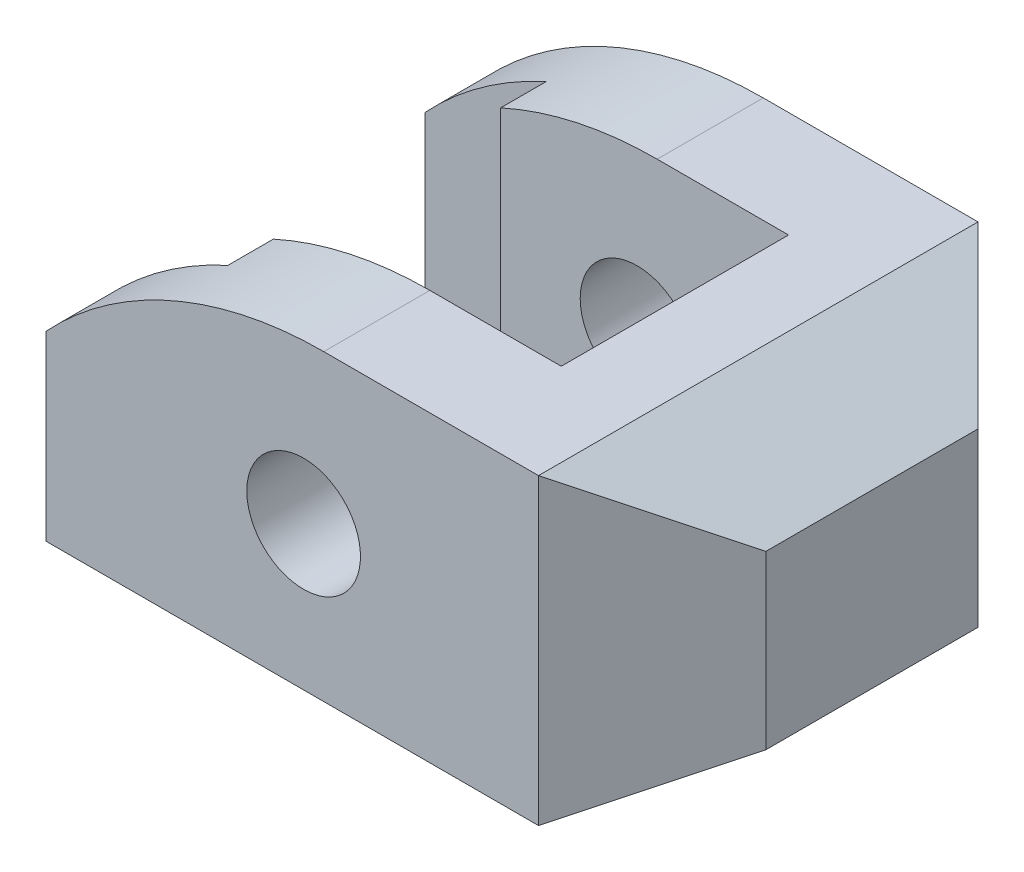
from build123d import *

# Parameters (mm, degrees)
SKETCH1_R           = 7.5
BOSS_EXTRUDE1_DEPTH = 58
SKETCH2_W           = 16
SKETCH2_H           = 42
CUT_EXTRUDE1_DEPTH  = 107.60206377
SKETCH3_W           = 38
SKETCH3_H           = 30
CUT_EXTRUDE2_DEPTH  = 107.60206377
CUT_EXTRUDE3_DEPTH  = 107.60206377


with BuildPart() as part:
    # Sketch1 → Boss-Extrude1 (new body)
    with BuildSketch(Plane.XY):
        with BuildLine():
            Line((0, 0), (65, 0))
            Line((65, 0), (80, 8.660254038))
            Line((80, 8.660254038), (80, 31.339745962))
            Line((80, 31.339745962), (65, 40))
            Line((65, 40), (36.66060556, 40))
            ThreePointArc((36.66060556, 40), (16.66060556, 35.82575695), (0, 24))
            Line((0, 24), (0, 0))
        make_face()
        with Locations(Location((34, 19, 0), (0, 0, 180))):
            Circle(SKETCH1_R, mode=Mode.SUBTRACT)
    extrude(amount=BOSS_EXTRUDE1_DEPTH)

    # Sketch2 → Cut-Extrude1 (cut, through all)
    with BuildSketch(Plane(origin=(0, 0, 0), x_dir=(1, 0, 0), z_dir=(0, 1, 0))):
        with Locations((8, -29)):
            Rectangle(SKETCH2_W, SKETCH2_H)
    extrude(amount=CUT_EXTRUDE1_DEPTH, mode=Mode.SUBTRACT)

    # Sketch3 → Cut-Extrude2 (cut, through all)
    with BuildSketch(Plane(origin=(0, 0, 0), x_dir=(1, 0, 0), z_dir=(0, 1, 0))):
        with Locations((35, -29)):
            Rectangle(SKETCH3_W, SKETCH3_H)
    extrude(amount=CUT_EXTRUDE2_DEPTH, mode=Mode.SUBTRACT)

    # Sketch4 → Cut-Extrude3 (cut, through all)
    with BuildSketch(Plane(origin=(0, 0, 0), x_dir=(1, 0, 0), z_dir=(0, 1, 0))):
        Polygon((65, 0), (80, -15), (80, 0), align=None)
        Polygon((65, -58), (80, -43), (80, -58), align=None)
    extrude(amount=CUT_EXTRUDE3_DEPTH, mode=Mode.SUBTRACT)


solid = part.part
